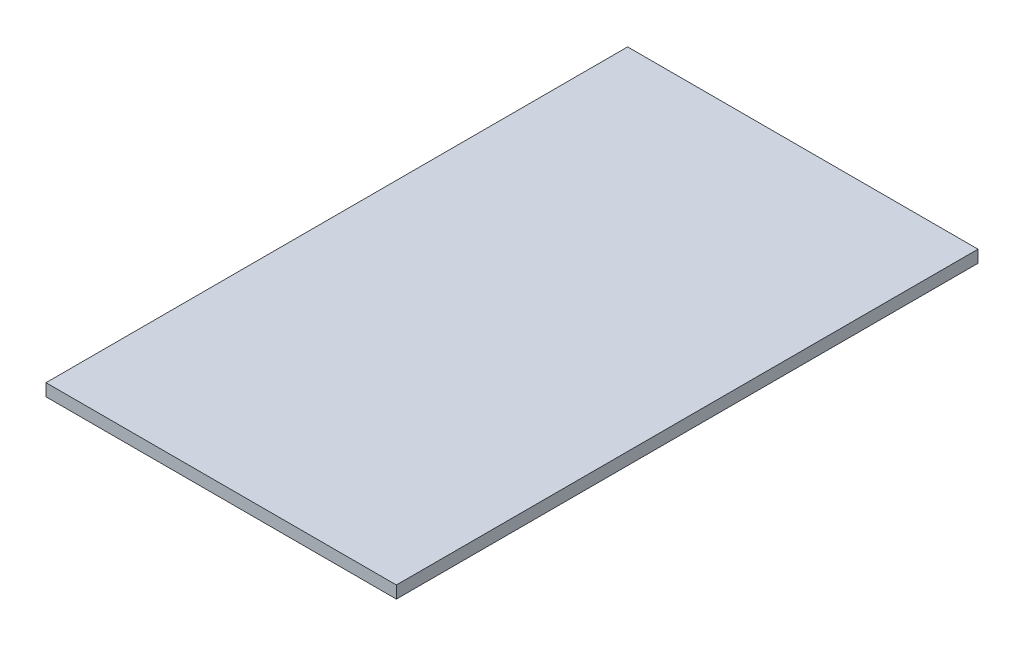
from build123d import *

# Parameters (mm, degrees)
SKETCH1_W           = 100
SKETCH1_H           = 166
MAIN_BODY_DEPTH     = 3.5
SKETCH2_W           = 72
SKETCH2_H           = 40
PCBS_AND_SUCH_DEPTH = 5


with BuildPart() as part:
    # Sketch1 → MAIN BODY (new body)
    with BuildSketch(Plane(origin=(0, 0, 0), x_dir=(1, 0, 0), z_dir=(0, 1, 0))):
        Rectangle(SKETCH1_W, SKETCH1_H)
    extrude(amount=MAIN_BODY_DEPTH)

    # Sketch2 → PCBs AND SUCH (add)
    with BuildSketch(Plane.XZ):
        with Locations((-10, -63)):
            Rectangle(SKETCH2_W, SKETCH2_H)
    extrude(amount=PCBS_AND_SUCH_DEPTH)


solid = part.part
